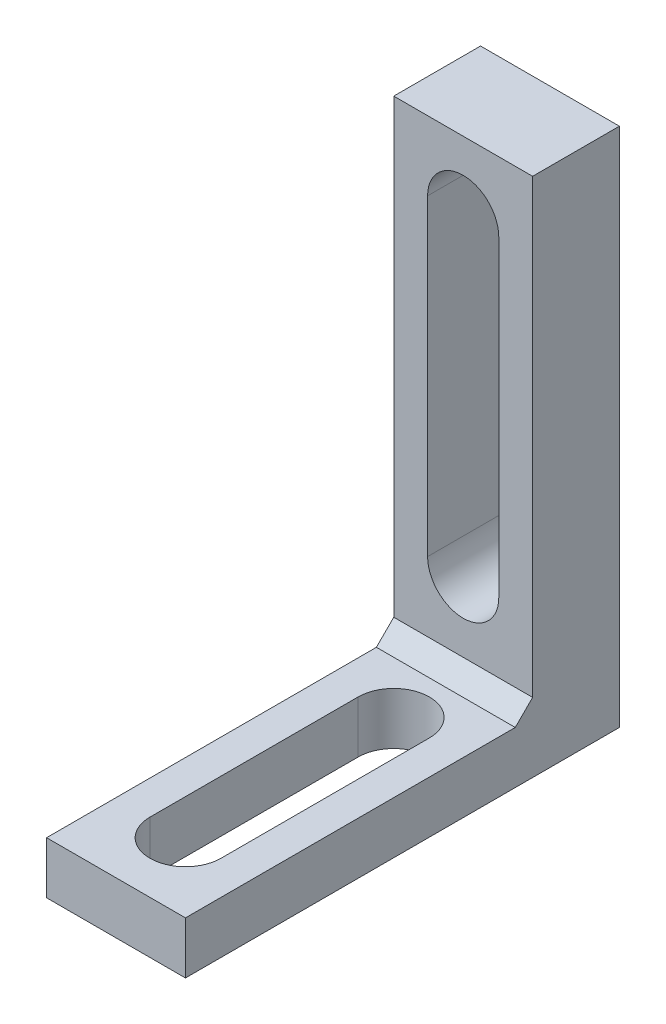
from build123d import *

# Parameters (mm, degrees)
BOSS_EXTRUDE1_DEPTH = 8
CUT_EXTRUDE1_DEPTH  = 8
CUT_EXTRUDE2_DEPTH  = 8
CHAMFER1_SIZE       = 1


with BuildPart() as part:
    # Sketch1 → Boss-Extrude1 (new body)
    with BuildSketch(Plane(origin=(0, 0, 0), x_dir=(0, 0, -1), z_dir=(1, 0, 0))):
        Polygon((0, 0), (25, 0), (25, 30), (20, 30), (20, 3), (0, 3), align=None)
    extrude(amount=BOSS_EXTRUDE1_DEPTH)

    # Sketch3 → Cut-Extrude1 (cut)
    with BuildSketch(Plane(origin=(0, 3, 0), x_dir=(1, 0, 0), z_dir=(0, 1, 0))):
        with BuildLine():
            Line((1.95, 4), (1.95, 16))
            ThreePointArc((1.95, 16), (4, 18.05), (6.05, 16))
            Line((6.05, 16), (6.05, 4))
            ThreePointArc((6.05, 4), (4, 1.95), (1.95, 4))
        make_face()
    extrude(amount=-CUT_EXTRUDE1_DEPTH, mode=Mode.SUBTRACT)

    # Sketch4 → Cut-Extrude2 (cut)
    with BuildSketch(Plane.XY.offset(-20)):
        with BuildLine():
            Line((6.05, 26), (6.05, 8))
            ThreePointArc((6.05, 8), (4, 5.95), (1.95, 8))
            Line((1.95, 8), (1.95, 26))
            ThreePointArc((1.95, 26), (4, 28.05), (6.05, 26))
        make_face()
    extrude(amount=-CUT_EXTRUDE2_DEPTH, mode=Mode.SUBTRACT)

    # Chamfer1
    chamfer1_edges = [part.edges().sort_by_distance(p)[0] for p in [
        (4, 3, -20),
    ]]
    chamfer(chamfer1_edges, length=CHAMFER1_SIZE)


solid = part.part
